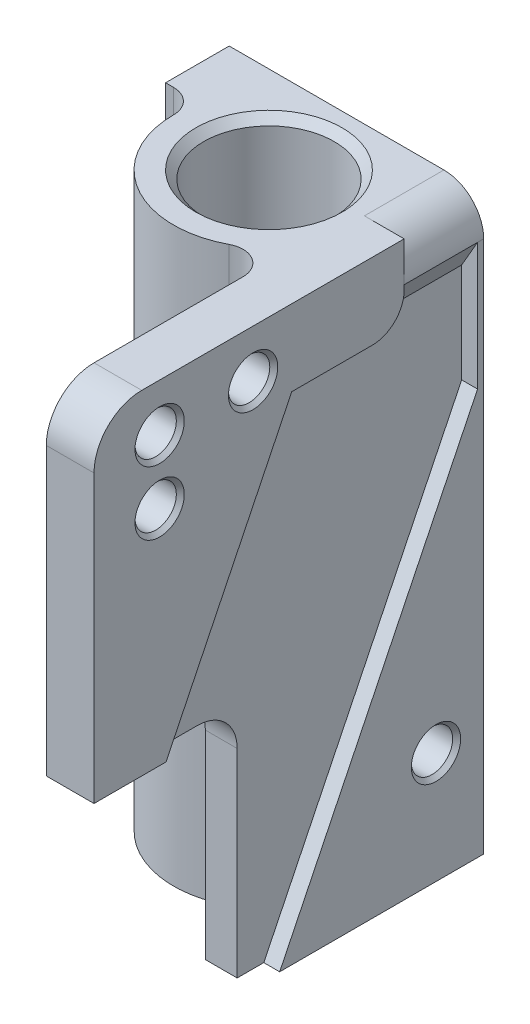
from build123d import *

# Parameters (mm, degrees)
SKETCH1_R               = 8.2
BOSS_EXTRUDE1_DEPTH     = 72
SKETCH2_R               = 2.6
CUT_EXTRUDE1_DEPTH      = 6
CHAMFER1_SIZE           = 0.5
CHAMFER2_SIZE           = 1
SKETCH3_R               = 2.6
CUT_EXTRUDE2_DEPTH      = 88.475710915
CUT_EXTRUDE3_DEPTH      = 10
CUT_EXTRUDE4_DEPTH      = 2
CUT_EXTRUDE5_DEPTH      = 10
CUT_EXTRUDE5_DEPTH_BACK = 10
CUT_EXTRUDE6_DEPTH      = 9.232013106
FILLET1_R               = 4
FILLET2_R               = 6
SKETCH9_R               = 2.6
CUT_EXTRUDE7_DEPTH      = 6
CHAMFER3_SIZE           = 0.5


with BuildPart() as part:
    # Sketch1 → Boss-Extrude1 (new body)
    with BuildSketch(Plane(origin=(0, 0, 0), x_dir=(1, 0, 0), z_dir=(0, 1, 0))):
        with BuildLine():
            Line((-16, 11), (16, 11))
            Line((16, 11), (16, -38))
            Line((16, -38), (10, -38))
            Line((10, -38), (10, -13.266499161))
            ThreePointArc((10, -13.266499161), (8.549193338, -10.697452646), (5.6, -10.613199329))
            ThreePointArc((5.6, -10.613199329), (-6.196773354, -10.276186063), (-12, 0))
            ThreePointArc((-12, 0), (-12.878679656, 2.121320344), (-15, 3))
            Line((-15, 3), (-16, 3))
            Line((-16, 3), (-16, 11))
        make_face()
        with Locations(Location((0, 0, 0), (0, 0, 270))):
            Circle(SKETCH1_R, mode=Mode.SUBTRACT)
    extrude(amount=BOSS_EXTRUDE1_DEPTH)

    # Sketch2 → Cut-Extrude1 (cut)
    with BuildSketch(Plane.XY.offset(-11)):
        with Locations((-11, 67)):
            Circle(SKETCH2_R)
        with Locations((-11, 5)):
            Circle(SKETCH2_R)
        with Locations((11, 67)):
            Circle(SKETCH2_R)
        with Locations((11, 5)):
            Circle(SKETCH2_R)
    extrude(amount=CUT_EXTRUDE1_DEPTH, mode=Mode.SUBTRACT)

    # Chamfer1
    chamfer1_edges = [part.edges().sort_by_distance(p)[0] for p in [
        (-13.6, 67, -11),
        (-13.6, 5, -11),
        (8.4, 67, -11),
        (8.4, 5, -11),
    ]]
    chamfer(chamfer1_edges, length=CHAMFER1_SIZE)

    # Chamfer2
    chamfer2_edges = [part.edges().sort_by_distance(p)[0] for p in [
        (0, 0, -8.2),
        (0, 72, -8.2),
    ]]
    chamfer(chamfer2_edges, length=CHAMFER2_SIZE)

    # Sketch3 → Cut-Extrude2 (cut, through all)
    with BuildSketch(Plane(origin=(16, 0, 0), x_dir=(0, 0, -1), z_dir=(1, 0, 0))):
        with Locations((-29.75, 66)):
            Circle(SKETCH3_R)
        with Locations((-29.75, 58)):
            Circle(SKETCH3_R)
    extrude(amount=-CUT_EXTRUDE2_DEPTH, mode=Mode.SUBTRACT)

    # Sketch4 → Cut-Extrude3 (cut)
    with BuildSketch(Plane(origin=(0, 0, -11), x_dir=(-1, 0, 0), z_dir=(0, 0, -1))):
        with BuildLine():
            Line((-11, 72), (-16, 72))
            Line((-16, 72), (-16, 67))
            ThreePointArc((-16, 67), (-14.535533906, 70.535533906), (-11, 72))
        make_face()
    extrude(amount=-CUT_EXTRUDE3_DEPTH, mode=Mode.SUBTRACT)

    # Sketch5 → Cut-Extrude4 (cut)
    with BuildSketch(Plane(origin=(16, 0, 0), x_dir=(0, 0, -1), z_dir=(1, 0, 0))):
        Polygon((10.232013106, 51.021676305), (-14.652921151, 0), (-38, 0), (-38, 11.441867396), (-13.136632097, 62.419326121), (10.232013106, 62.419326121), align=None)
    extrude(amount=-CUT_EXTRUDE4_DEPTH, mode=Mode.SUBTRACT)

    # Sketch6 → Cut-Extrude5 (cut, two sides: drawn at the far end of the back side and taken through both)
    with BuildSketch(Plane(origin=(14, 0, 0), x_dir=(0, 0, -1), z_dir=(1, 0, 0)).offset(-CUT_EXTRUDE5_DEPTH_BACK)):
        with BuildLine():
            Line((-38, 0), (-18, 0))
            Line((-18, 0), (-18, 25))
            ThreePointArc((-18, 25), (-19.464466094, 28.535533906), (-23, 30))
            Line((-23, 30), (-38, 30))
            Line((-38, 30), (-38, 0))
        make_face()
    extrude(amount=CUT_EXTRUDE5_DEPTH + CUT_EXTRUDE5_DEPTH_BACK, mode=Mode.SUBTRACT)

    # Sketch8 → Cut-Extrude6 (cut)
    with BuildSketch(Plane(origin=(0, 0, -1), x_dir=(-1, 0, 0), z_dir=(0, 0, -1))):
        Polygon((-16, 67), (-16, 62.419326121), (-14, 62.419326121), (-14, 63.535898385), align=None)
    extrude(amount=CUT_EXTRUDE6_DEPTH, mode=Mode.SUBTRACT)

    # Fillet1
    fillet1_edges = [part.edges().sort_by_distance(p)[0] for p in [
        (15, 62.419326121, -1),
    ]]
    fillet(fillet1_edges, radius=FILLET1_R)

    # Fillet2
    fillet2_edges = [part.edges().sort_by_distance(p)[0] for p in [
        (13, 72, 38),
    ]]
    fillet(fillet2_edges, radius=FILLET2_R)

    # Sketch9 → Cut-Extrude7 (cut)
    with BuildSketch(Plane(origin=(16, 0, 0), x_dir=(0, 0, -1), z_dir=(1, 0, 0))):
        with Locations((-18, 66)):
            Circle(SKETCH9_R)
        with Locations((5, 14)):
            Circle(SKETCH9_R)
    extrude(amount=-CUT_EXTRUDE7_DEPTH, mode=Mode.SUBTRACT)

    # Chamfer3
    chamfer3_edges = [part.edges().sort_by_distance(p)[0] for p in [
        (16, 66, 20.6),
        (16, 14, -2.4),
        (16, 66, 32.35),
        (16, 58, 32.35),
    ]]
    chamfer(chamfer3_edges, length=CHAMFER3_SIZE)


solid = part.part
